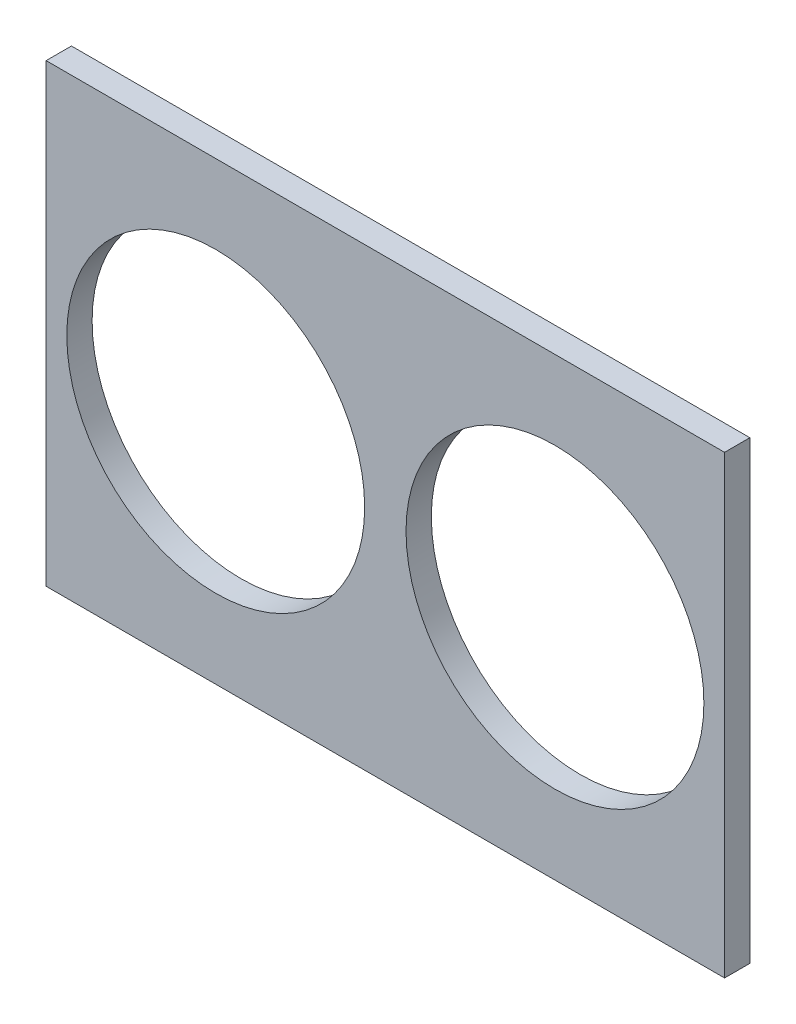
from build123d import *

# Parameters (mm, degrees)
SKETCH1_W           = 37.85108
SKETCH1_H           = 25.4
SKETCH1_R           = 8.309045905
BOSS_EXTRUDE1_DEPTH = 1.41224


with BuildPart() as part:
    # Sketch1 → Boss-Extrude1 (new body)
    with BuildSketch(Plane.XY):
        with Locations((18.92554, -12.7)):
            Rectangle(SKETCH1_W, SKETCH1_H)
        with Locations((9.46277, -12.7)):
            Circle(SKETCH1_R, mode=Mode.SUBTRACT)
        with Locations(Location((28.38831, -12.7, 0), (0, 0, 180))):
            Circle(SKETCH1_R, mode=Mode.SUBTRACT)
    extrude(amount=-BOSS_EXTRUDE1_DEPTH)


solid = part.part
